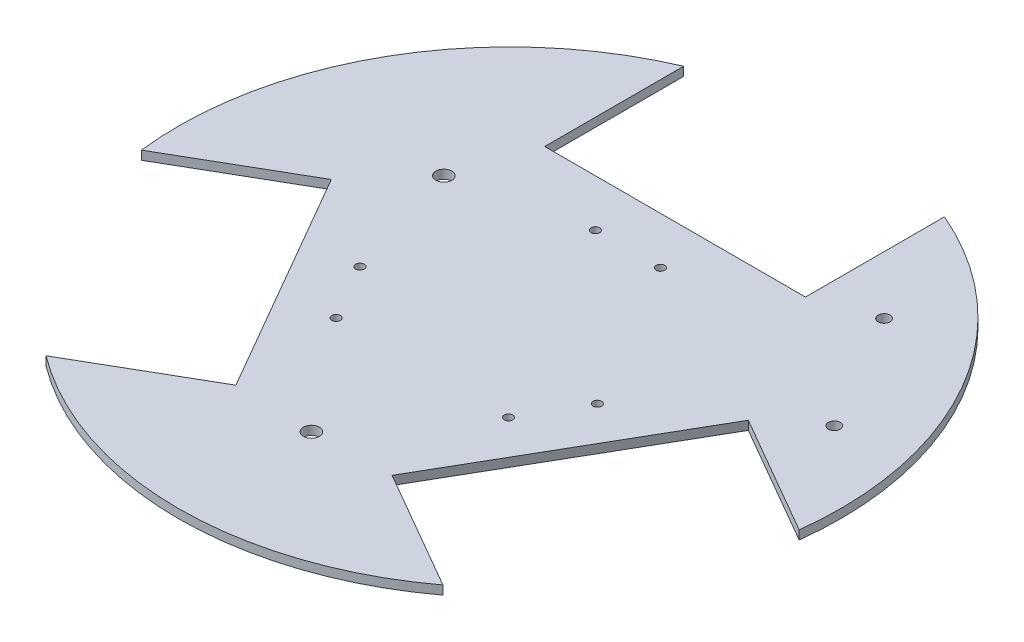
from build123d import *

# Parameters (mm, degrees)
SKETCH1_R           = 2.1463
SKETCH1_R_2         = 1.14935
SKETCH1_R_3         = 1.5875
BOSS_EXTRUDE1_DEPTH = 2.3622


with BuildPart() as part:
    # Sketch1 → Boss-Extrude1 (new body)
    with BuildSketch(Plane(origin=(0, 0, 0), x_dir=(1, 0, 0), z_dir=(0, 1, 0))):
        with BuildLine():
            Line((-35, 44.411902139), (-35, 81.720315712))
            ThreePointArc((-35, 81.720315712), (-76.989658396, 44.45), (-88.271869412, -10.549268723))
            Line((-88.271869412, -10.549268723), (-55.961835482, 8.104938063))
            Line((-55.961835482, 8.104938063), (-20.961835482, -52.516840202))
            Line((-20.961835482, -52.516840202), (-53.271869412, -71.171046988))
            ThreePointArc((-53.271869412, -71.171046988), (0, -88.9), (53.271869412, -71.171046988))
            Line((53.271869412, -71.171046988), (20.961835482, -52.516840202))
            Line((20.961835482, -52.516840202), (55.961835482, 8.104938063))
            Line((55.961835482, 8.104938063), (88.271869412, -10.549268723))
            ThreePointArc((88.271869412, -10.549268723), (76.989658396, 44.45), (35, 81.720315712))
            Line((35, 81.720315712), (35, 44.411902139))
            Line((35, 44.411902139), (-35, 44.411902139))
        make_face()
        with Locations(Location((-41.747414599, 24.102881057, 0), (0, 0, 270))):
            Circle(SKETCH1_R, mode=Mode.SUBTRACT)
        with Locations(Location((-8.73125, 31.75, 0), (0, 0, 270))):
            Circle(SKETCH1_R_2, mode=Mode.SUBTRACT)
        with Locations(Location((50.529406911, 49.981355026, 0), (0, 0, 270))):
            Circle(SKETCH1_R_3, mode=Mode.SUBTRACT)
        with Locations(Location((0, -53.205762114, 0), (0, 0, 90))):
            Circle(SKETCH1_R, mode=Mode.SUBTRACT)
        with Locations(Location((68.785656911, 18.36060247, 0), (0, 0, 270))):
            Circle(SKETCH1_R_3, mode=Mode.SUBTRACT)
        with Locations(Location((8.73125, 31.75, 0), (0, 0, 270))):
            Circle(SKETCH1_R_2, mode=Mode.SUBTRACT)
        with Locations(Location((31.86193157, -8.313515693, 0), (0, 0, 270))):
            Circle(SKETCH1_R_2, mode=Mode.SUBTRACT)
        with Locations(Location((23.13068157, -23.436484307, 0), (0, 0, 270))):
            Circle(SKETCH1_R_2, mode=Mode.SUBTRACT)
        with Locations(Location((-31.86193157, -8.313515693, 0), (0, 0, 270))):
            Circle(SKETCH1_R_2, mode=Mode.SUBTRACT)
        with Locations(Location((-23.13068157, -23.436484307, 0), (0, 0, 270))):
            Circle(SKETCH1_R_2, mode=Mode.SUBTRACT)
    extrude(amount=BOSS_EXTRUDE1_DEPTH)


solid = part.part
